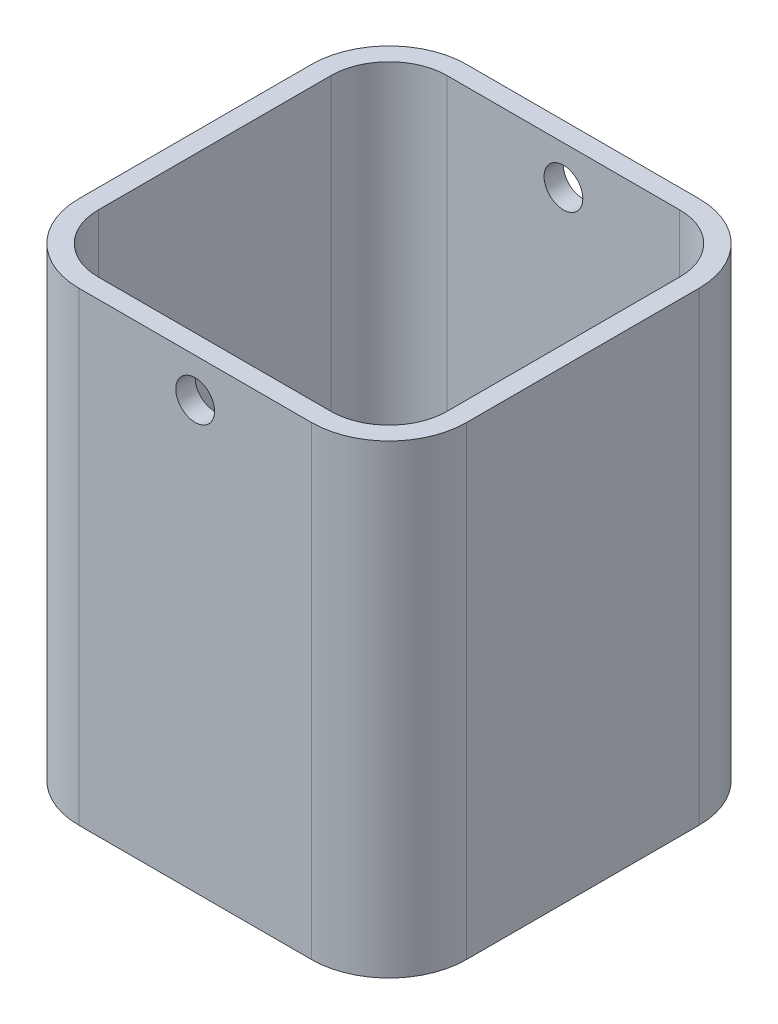
from build123d import *

# Parameters (mm, degrees)
SKETCH1_W           = 50
SKETCH1_H           = 50
BOSS_EXTRUDE1_DEPTH = 60
FILLET1_R           = 10
SHELL1_T            = -2.5
SKETCH2_R           = 2.5
CUT_EXTRUDE1_DEPTH  = 93.736184955


with BuildPart() as part:
    # Sketch1 → Boss-Extrude1 (new body)
    with BuildSketch(Plane(origin=(0, 0, 0), x_dir=(1, 0, 0), z_dir=(0, 1, 0))):
        with Locations((25, 25)):
            Rectangle(SKETCH1_W, SKETCH1_H)
    extrude(amount=BOSS_EXTRUDE1_DEPTH)

    # Fillet1
    fillet1_edges = [part.edges().sort_by_distance(p)[0] for p in [
        (0, 30, -50),
        (50, 30, -50),
        (50, 30, 0),
        (0, 30, 0),
    ]]
    fillet(fillet1_edges, radius=FILLET1_R)

    # Shell1
    shell1_openings = [part.faces().sort_by_distance(p)[0] for p in [
        (25, 60, -25),
    ]]
    offset(amount=SHELL1_T, openings=shell1_openings, kind=Kind.INTERSECTION)

    # Sketch2 → Cut-Extrude1 (cut, through all)
    with BuildSketch(Plane.XY):
        with Locations((25, 55)):
            Circle(SKETCH2_R)
    extrude(amount=-CUT_EXTRUDE1_DEPTH, mode=Mode.SUBTRACT)


solid = part.part
